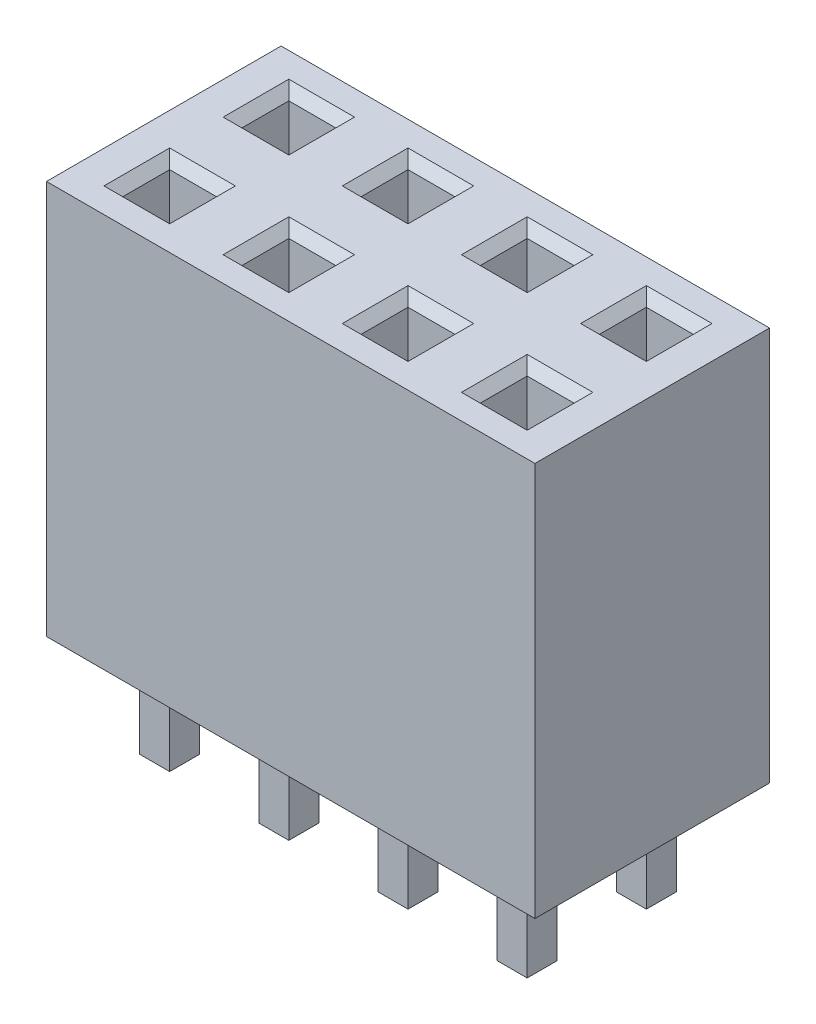
from build123d import *

# Parameters (mm, degrees)
SKETCH_1_W                         = 2.79
SKETCH_1_H                         = 5
EXTRUDE_1_DEPTH                    = 8.4
SKETCH_2_W                         = 1
SKETCH_2_H                         = 1
CUT_EXTRUDE_1_DEPTH                = 8
CHAMFER_1_SIZE                     = 0.2
SKETCH_3_W                         = 0.64
SKETCH_3_H                         = 0.64
EXTRUDE_2_DEPTH                    = 2.29
CHAMFER_2_SIZE                     = 0.2
PATTERN_LINEAR_1_COUNT             = 4
PATTERN_LINEAR_1_PITCH             = 2.54
CHAMFER_1_OF_PATTERN_LINEAR_1_SIZE = 0.2
CHAMFER_2_OF_PATTERN_LINEAR_1_SIZE = 0.2


with BuildPart() as part:
    # Эскиз1 → Бобышка-Вытянуть1 (new body)
    with BuildSketch(Plane(origin=(0, 0, 0), x_dir=(1, 0, 0), z_dir=(0, 1, 0))):
        Rectangle(SKETCH_1_W, SKETCH_1_H)
    extrude_1 = extrude(amount=EXTRUDE_1_DEPTH)

    # Эскиз2 → Вырез-Вытянуть1 (cut)
    with BuildSketch(Plane(origin=(0, 8.4, 0), x_dir=(1, 0, 0), z_dir=(0, 1, 0))):
        with Locations((0, 1.27)):
            Rectangle(SKETCH_2_W, SKETCH_2_H)
        with Locations((0, -1.27)):
            Rectangle(SKETCH_2_W, SKETCH_2_H)
    cut_extrude_1 = extrude(amount=-CUT_EXTRUDE_1_DEPTH, mode=Mode.SUBTRACT)

    # Фаска1
    chamfer_1_edges = [part.edges().sort_by_distance(p)[0] for p in [
        (0.5, 8.4, -1.27),
        (0, 8.4, -1.77),
        (-0.5, 8.4, -1.27),
        (0, 8.4, -0.77),
        (0, 8.4, 1.77),
        (0.5, 8.4, 1.27),
        (0, 8.4, 0.77),
        (-0.5, 8.4, 1.27),
    ]]
    chamfer(chamfer_1_edges, length=CHAMFER_1_SIZE)

    # Эскиз3 → Бобышка-Вытянуть2 (add)
    with BuildSketch(Plane(origin=(0, 0, 0), x_dir=(-1, 0, 0), z_dir=(0, -1, 0))):
        with Locations((0, 1.27)):
            Rectangle(SKETCH_3_W, SKETCH_3_H)
        with Locations((0, -1.27)):
            Rectangle(SKETCH_3_W, SKETCH_3_H)
    extrude_2 = extrude(amount=EXTRUDE_2_DEPTH)

    # Фаска2
    chamfer_2_edges = [part.edges().sort_by_distance(p)[0] for p in [
        (0.32, -2.29, -1.27),
        (0, -2.29, -0.95),
        (-0.32, -2.29, -1.27),
        (0, -2.29, -1.59),
        (-0.32, -2.29, 1.27),
        (0, -2.29, 0.95),
        (0.32, -2.29, 1.27),
        (0, -2.29, 1.59),
    ]]
    chamfer(chamfer_2_edges, length=CHAMFER_2_SIZE)

    # Линейный массив1: Бобышка-Вытянуть1, Вырез-Вытянуть1, Бобышка-Вытянуть2 ×4
    with Locations(*[(i * PATTERN_LINEAR_1_PITCH, 0, 0) for i in range(1, PATTERN_LINEAR_1_COUNT)]):
        add(extrude_1)
        add(cut_extrude_1, mode=Mode.SUBTRACT)
        add(extrude_2)

    # Фаска1 of Линейный массив1
    chamfer_1_of_pattern_linear_1_edges = [part.edges().sort_by_distance(p)[0] for p in [
        (3.04, 8.4, -1.27),
        (2.54, 8.4, -1.77),
        (2.04, 8.4, -1.27),
        (2.54, 8.4, -0.77),
        (2.54, 8.4, 1.77),
        (3.04, 8.4, 1.27),
        (2.54, 8.4, 0.77),
        (2.04, 8.4, 1.27),
        (5.58, 8.4, -1.27),
        (5.08, 8.4, -1.77),
        (4.58, 8.4, -1.27),
        (5.08, 8.4, -0.77),
        (5.08, 8.4, 1.77),
        (5.58, 8.4, 1.27),
        (5.08, 8.4, 0.77),
        (4.58, 8.4, 1.27),
        (8.12, 8.4, -1.27),
        (7.62, 8.4, -1.77),
        (7.12, 8.4, -1.27),
        (7.62, 8.4, -0.77),
        (7.62, 8.4, 1.77),
        (8.12, 8.4, 1.27),
        (7.62, 8.4, 0.77),
        (7.12, 8.4, 1.27),
    ]]
    chamfer(chamfer_1_of_pattern_linear_1_edges, length=CHAMFER_1_OF_PATTERN_LINEAR_1_SIZE)

    # Фаска2 of Линейный массив1
    chamfer_2_of_pattern_linear_1_edges = [part.edges().sort_by_distance(p)[0] for p in [
        (2.86, -2.29, -1.27),
        (2.54, -2.29, -0.95),
        (2.22, -2.29, -1.27),
        (2.54, -2.29, -1.59),
        (2.22, -2.29, 1.27),
        (2.54, -2.29, 0.95),
        (2.86, -2.29, 1.27),
        (2.54, -2.29, 1.59),
        (5.4, -2.29, -1.27),
        (5.08, -2.29, -0.95),
        (4.76, -2.29, -1.27),
        (5.08, -2.29, -1.59),
        (4.76, -2.29, 1.27),
        (5.08, -2.29, 0.95),
        (5.4, -2.29, 1.27),
        (5.08, -2.29, 1.59),
        (7.94, -2.29, -1.27),
        (7.62, -2.29, -0.95),
        (7.3, -2.29, -1.27),
        (7.62, -2.29, -1.59),
        (7.3, -2.29, 1.27),
        (7.62, -2.29, 0.95),
        (7.94, -2.29, 1.27),
        (7.62, -2.29, 1.59),
    ]]
    chamfer(chamfer_2_of_pattern_linear_1_edges, length=CHAMFER_2_OF_PATTERN_LINEAR_1_SIZE)


solid = part.part
